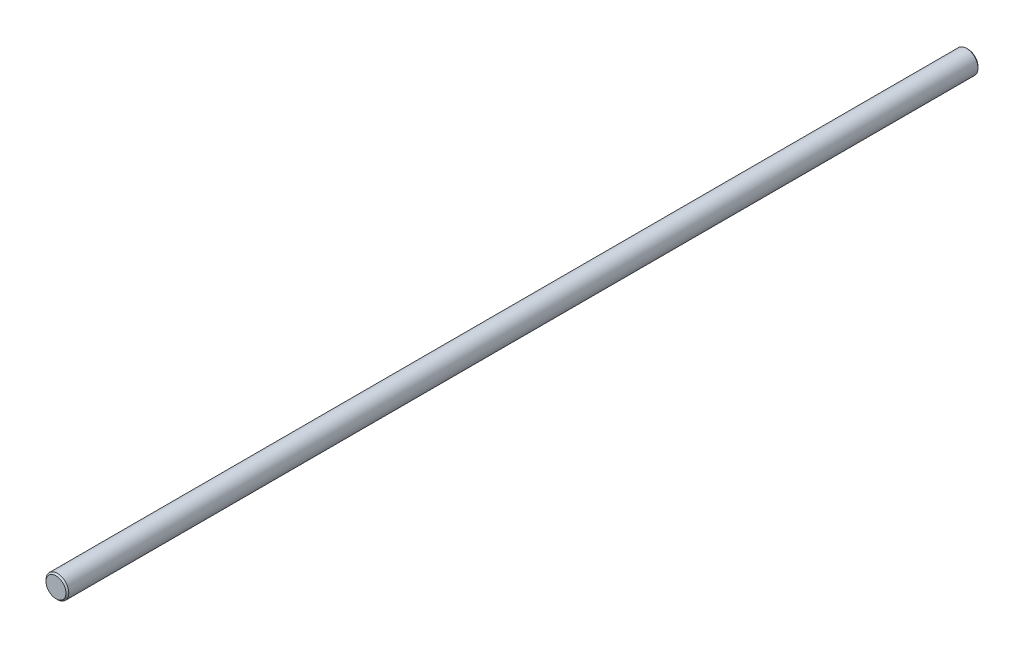
from build123d import *

# Parameters (mm, degrees)
SZKIC1_R                    = 4
DODANIE_WYCI_GNI_CIE1_DEPTH = 320
SFAZOWANIE1_SIZE            = 0.5


with BuildPart() as part:
    # Szkic1 → Dodanie-wyciągnięcie1 (new body)
    with BuildSketch(Plane.XY):
        Circle(SZKIC1_R)
    extrude(amount=DODANIE_WYCI_GNI_CIE1_DEPTH)

    # Sfazowanie1
    sfazowanie1_edges = [part.edges().sort_by_distance(p)[0] for p in [
        (-4, 0, 0),
        (-4, 0, 320),
    ]]
    chamfer(sfazowanie1_edges, length=SFAZOWANIE1_SIZE)


solid = part.part
